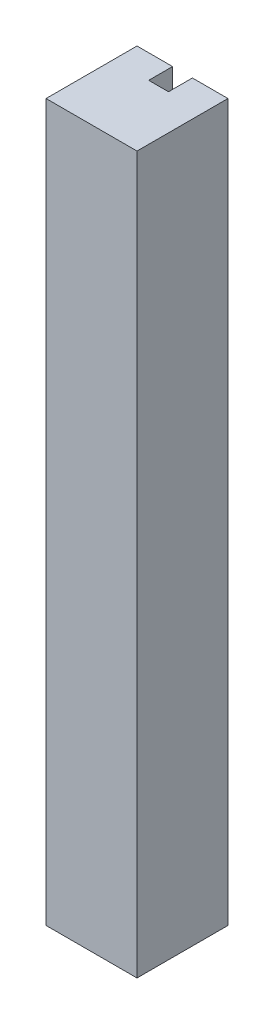
from build123d import *

# Parameters (mm, degrees)
BOSS_EXTRU_1_DEPTH = 300


with BuildPart() as part:
    # Esquisse1 → Boss.-Extru.1 (new body)
    with BuildSketch(Plane(origin=(0, 0, 0), x_dir=(1, 0, 0), z_dir=(0, 1, 0))):
        Polygon((0, 0), (0, 38.1), (14.9, 38.1), (14.9, 28.1), (23.2, 28.1), (23.2, 38.1), (38.1, 38.1), (38.1, 0), align=None)
    extrude(amount=BOSS_EXTRU_1_DEPTH)


solid = part.part
